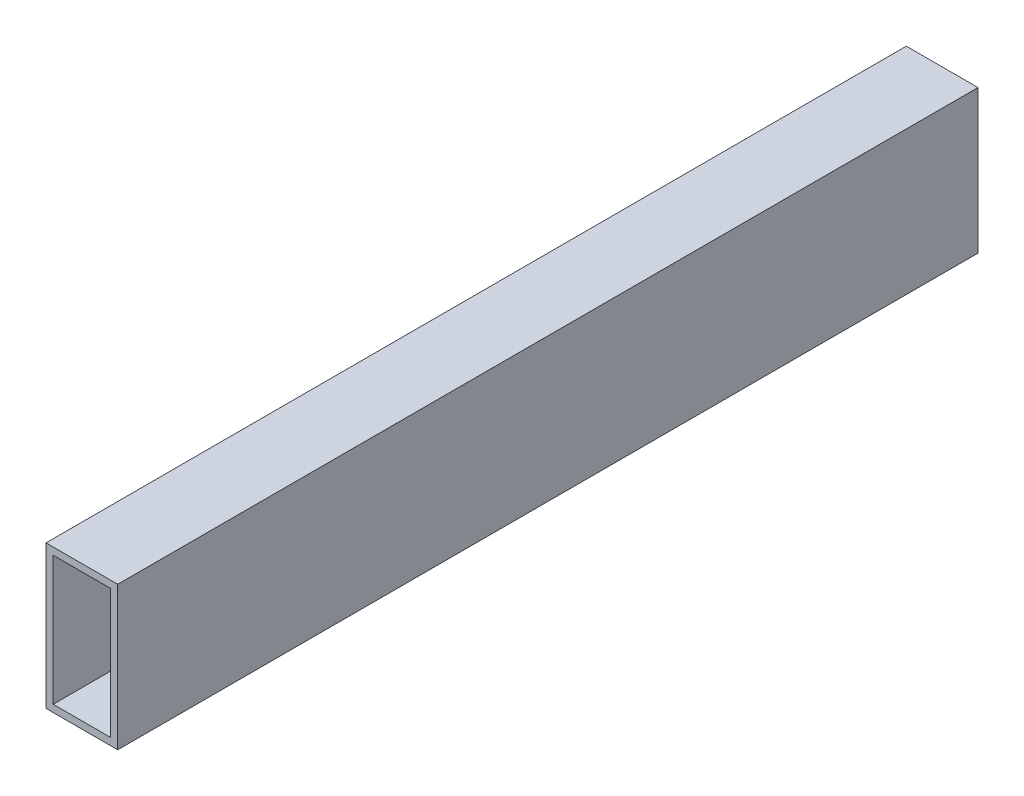
from build123d import *

# Parameters (mm, degrees)
SKETCH1_W           = 25
SKETCH1_H           = 50
SKETCH1_W_2         = 20
SKETCH1_H_2         = 45
BOSS_EXTRUDE1_DEPTH = 300


with BuildPart() as part:
    # Sketch1 → Boss-Extrude1 (new body)
    with BuildSketch(Plane.XY):
        Rectangle(SKETCH1_W, SKETCH1_H)
        Rectangle(SKETCH1_W_2, SKETCH1_H_2, mode=Mode.SUBTRACT)
    extrude(amount=BOSS_EXTRUDE1_DEPTH)


solid = part.part
